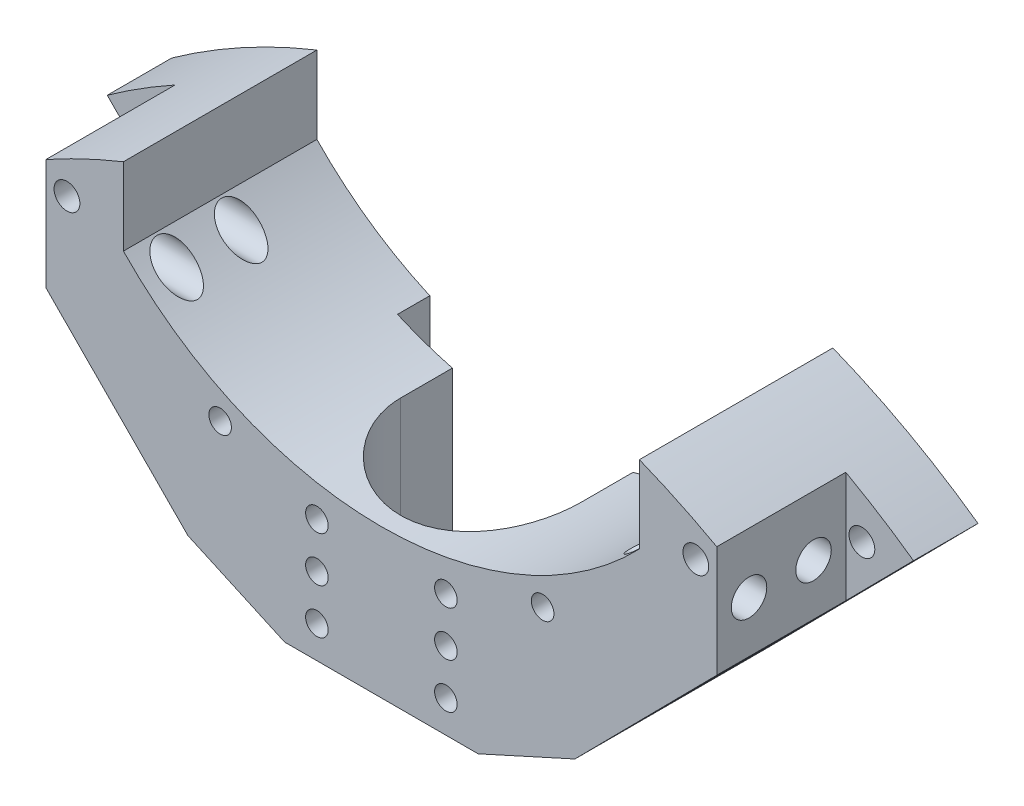
from build123d import *

# Parameters (mm, degrees)
BOSS_EXTRUDE1_DEPTH     = 30
SKETCH2_W               = 10.5
SKETCH2_H               = 29.263002651
CUT_EXTRUDE1_DEPTH      = 20
CUT_EXTRUDE2_DEPTH      = 87.661698576
CUT_EXTRUDE3_DEPTH      = 92.501954944
CUT_EXTRUDE3_DEPTH_BACK = 92.501954944
SKETCH4_R               = 2.75
CUT_EXTRUDE5_DEPTH      = 89.727716958
CUT_EXTRUDE5_DEPTH_BACK = 89.727716958
SKETCH6_R               = 2
SKETCH9_W               = 45
SKETCH9_H               = 10
CUT_EXTRUDE8_DEPTH      = 92.501954944
SKETCH10_R              = 1.75
CUT_EXTRUDE9_DEPTH      = 92.501954944
SKETCH12_R              = 1.75
CUT_EXTRUDE11_DEPTH     = 92.501954944
LPATTERN1_COUNT         = 3
LPATTERN1_PITCH         = 7
SKETCH13_R              = 4
CUT_EXTRUDE12_DEPTH     = 5


with BuildPart() as part:
    # Sketch1 → Boss-Extrude1 (new body)
    with BuildSketch(Plane.XY):
        with BuildLine():
            Line((-40, -7.718989783), (-40, -19.718989783))
            ThreePointArc((-40, -19.718989783), (0, -36.718989783), (40, -19.718989783))
            Line((40, -19.718989783), (40, -7.718989783))
            ThreePointArc((40, -7.718989783), (51.618678504, -13.203859944), (62.5, -20.035721577))
            Line((62.5, -20.035721577), (30, -52.913710263))
            Line((30, -52.913710263), (15, -59.718989783))
            Line((15, -59.718989783), (-15, -59.718989783))
            Line((-15, -59.718989783), (-30, -52.913710263))
            Line((-30, -52.913710263), (-62.5, -20.035721577))
            ThreePointArc((-62.5, -20.035721577), (-51.618678504, -13.203859944), (-40, -7.718989783))
        make_face()
    extrude(amount=BOSS_EXTRUDE1_DEPTH)

    # Sketch2 → Cut-Extrude1 (cut)
    with BuildSketch(Plane.XY.offset(30)):
        with Locations((-57.25, -28.04510486)):
            Rectangle(SKETCH2_W, SKETCH2_H)
        with Locations((57.25, -28.04510486)):
            Rectangle(SKETCH2_W, SKETCH2_H)
    extrude(amount=-CUT_EXTRUDE1_DEPTH, mode=Mode.SUBTRACT)

    # Sketch3 → Cut-Extrude2 (cut, through all)
    with BuildSketch(Plane.XZ.offset(59.718989783)):
        with BuildLine():
            Line((-14, 13), (-14, 0))
            Line((-14, 0), (14, 0))
            Line((14, 0), (14, 13))
            ThreePointArc((14, 13), (0, 27), (-14, 13))
        make_face()
    extrude(amount=-CUT_EXTRUDE2_DEPTH, mode=Mode.SUBTRACT)

    # Sketch4 → Cut-Extrude3 (cut, two sides: drawn at the far end of the back side and taken through both)
    with BuildSketch(Plane(origin=(0, 0, 0), x_dir=(0, 0, -1), z_dir=(1, 0, 0)).offset(-CUT_EXTRUDE3_DEPTH_BACK)):
        with Locations((-15, -22.718989783)):
            Circle(SKETCH4_R)
        with Locations((-25, -22.718989783)):
            Circle(SKETCH4_R)
    extrude(amount=CUT_EXTRUDE3_DEPTH + CUT_EXTRUDE3_DEPTH_BACK, mode=Mode.SUBTRACT)

    # Sketch6 → Cut-Extrude5 (cut, two sides: drawn at the far end of the back side and taken through both)
    with BuildSketch(Plane.XY.offset(10).offset(-CUT_EXTRUDE5_DEPTH_BACK)):
        with Locations((-54.5, -21.535721577)):
            Circle(SKETCH6_R)
        with Locations((54.5, -21.535721577)):
            Circle(SKETCH6_R)
        with Locations((-48.75, -16.718989783)):
            Circle(SKETCH6_R)
        with Locations((48.75, -16.718989783)):
            Circle(SKETCH6_R)
    extrude(amount=CUT_EXTRUDE5_DEPTH + CUT_EXTRUDE5_DEPTH_BACK, mode=Mode.SUBTRACT)

    # Sketch9 → Cut-Extrude8 (cut, through all)
    with BuildSketch(Plane(origin=(0, 0, 0), x_dir=(1, 0, 0), z_dir=(0, 1, 0))):
        Rectangle(SKETCH9_W, SKETCH9_H)
    extrude(amount=-CUT_EXTRUDE8_DEPTH, mode=Mode.SUBTRACT)

    # Sketch10 → Cut-Extrude9 (cut, through all)
    with BuildSketch(Plane.XY.offset(30)):
        with Locations((-25, -35.035721577)):
            Circle(SKETCH10_R)
        with Locations((25, -35.035721577)):
            Circle(SKETCH10_R)
    extrude(amount=-CUT_EXTRUDE9_DEPTH, mode=Mode.SUBTRACT)

    # Sketch12 → Cut-Extrude11 (cut, through all)
    with BuildSketch(Plane.XY.offset(30)):
        with Locations((-10, -54.718989783)):
            Circle(SKETCH12_R)
        with Locations((10, -54.718989783)):
            Circle(SKETCH12_R)
    cut_extrude11 = extrude(amount=-CUT_EXTRUDE11_DEPTH, mode=Mode.SUBTRACT)

    # LPattern1: Cut-Extrude11 ×3
    with Locations(*[(0, i * LPATTERN1_PITCH, 0) for i in range(1, LPATTERN1_COUNT)]):
        add(cut_extrude11, mode=Mode.SUBTRACT)

    # Sketch13 → Cut-Extrude12 (cut)
    with BuildSketch(Plane(origin=(0, 0, 0), x_dir=(-1, 0, 0), z_dir=(0, 0, -1))):
        with Locations((-48.75, -16.718989783)):
            Circle(SKETCH13_R)
        with Locations((48.75, -16.718989783)):
            Circle(SKETCH13_R)
    extrude(amount=-CUT_EXTRUDE12_DEPTH, mode=Mode.SUBTRACT)


solid = part.part
